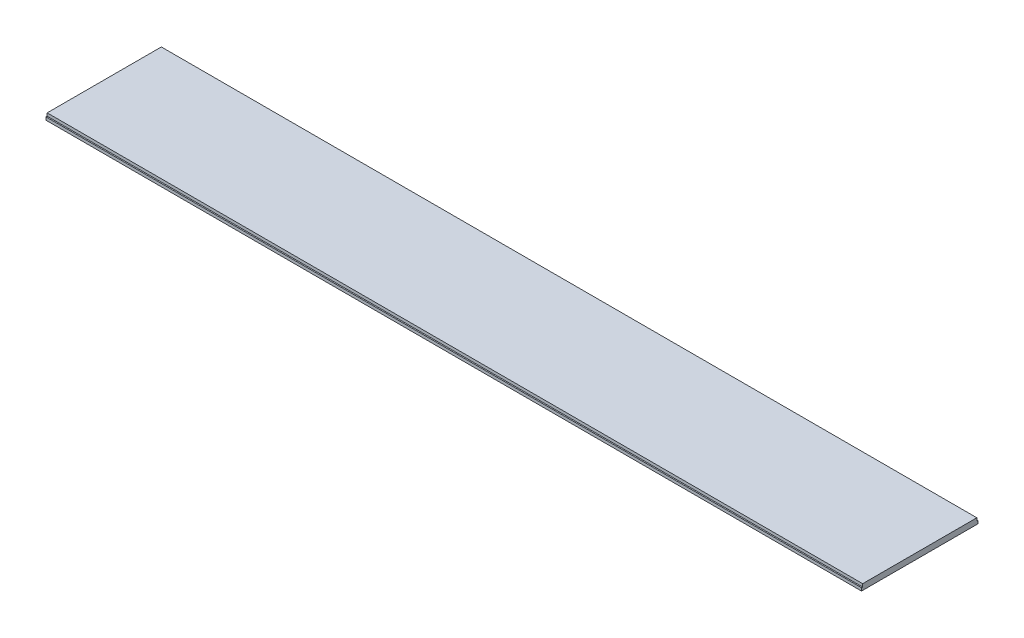
from build123d import *

# Parameters (mm, degrees)
SKETCH_1_W          = 1400
SKETCH_1_H          = 200
EXTRUDE_1_DEPTH     = 10
SKETCH_2_W          = 1400
SKETCH_2_H          = 2
CUT_EXTRUDE_1_DEPTH = 5


with BuildPart() as part:
    # Эскиз1 → Бобышка-Вытянуть1 (new body)
    with BuildSketch(Plane(origin=(0, 0, 0), x_dir=(1, 0, 0), z_dir=(0, 1, 0))):
        with Locations((-700, -100)):
            Rectangle(SKETCH_1_W, SKETCH_1_H)
    extrude(amount=EXTRUDE_1_DEPTH)

    # Эскиз2 → Вырез-Вытянуть1 (cut)
    with BuildSketch(Plane(origin=(0, 10, 0), x_dir=(1, 0, 0), z_dir=(0, 1, 0))):
        with Locations((-700, -1)):
            Rectangle(SKETCH_2_W, SKETCH_2_H)
        with Locations((-700, -199)):
            Rectangle(SKETCH_2_W, SKETCH_2_H)
    extrude(amount=-CUT_EXTRUDE_1_DEPTH, mode=Mode.SUBTRACT)


solid = part.part
